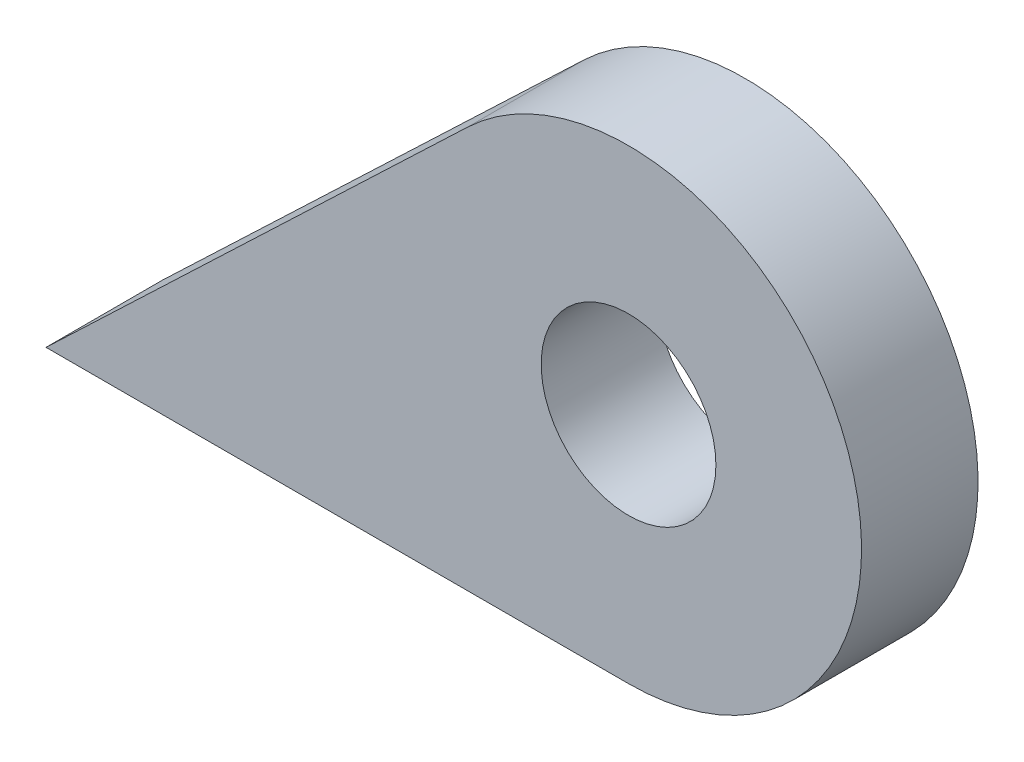
from build123d import *

# Parameters (mm, degrees)
SKETCH1_R           = 6.35
SKETCH1_R_2         = 2.38125
BOSS_EXTRUDE1_DEPTH = 3.175


with BuildPart() as part:
    # Sketch1 → Boss-Extrude1 (new body)
    # profile 1 of 2: a face of its own
    with BuildSketch(Plane.XY):
        with BuildLine():
            Line((-15.875, -6.35), (0, -6.35))
            ThreePointArc((0, -6.35), (-5.895826987, -2.358330795), (-4.379310345, 4.598275862))
            Line((-4.379310345, 4.598275862), (-15.875, -6.35))
        make_face()
    # profile 2 of 2: a face of its own
    with BuildSketch(Plane.XY):
        Circle(SKETCH1_R)
        Circle(SKETCH1_R_2, mode=Mode.SUBTRACT)
    extrude(amount=BOSS_EXTRUDE1_DEPTH)


solid = part.part
